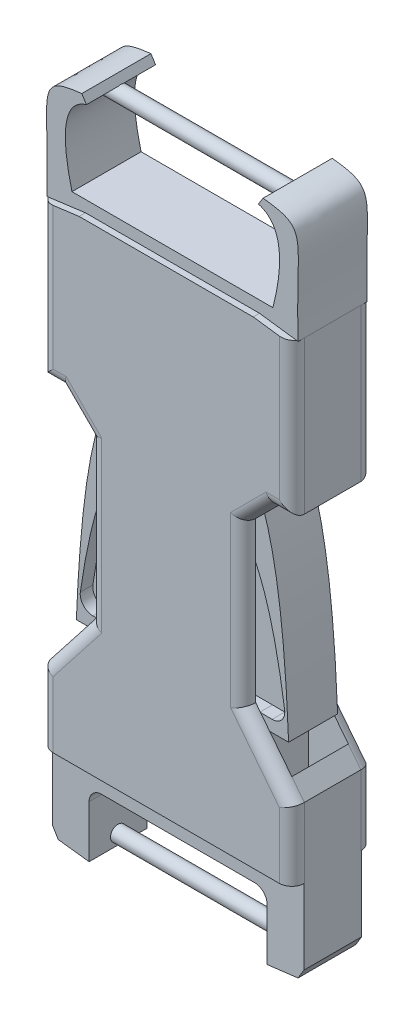
from build123d import *

# Parameters (mm, degrees)
BOSS_EXTRUDE1_DEPTH      = 3.25
FILLET1_R                = 1
SKETCH2_W                = 18
SKETCH2_H                = 4.5
CUT_EXTRUDE1_DEPTH       = 36.5
BOSS_EXTRUDE2_START      = -0.5
BOSS_EXTRUDE2_DEPTH      = 5.5
BOSS_EXTRUDE3_DEPTH      = 8
BOSS_EXTRUDE3_DEPTH_BACK = 8
SKETCH4_R                = 0.6
BOSS_EXTRUDE4_DEPTH      = 1.95
BOSS_EXTRUDE5_START      = -0.95
BOSS_EXTRUDE5_DEPTH      = 4.6
BOSS_EXTRUDE6_DEPTH      = 8
BOSS_EXTRUDE6_DEPTH_BACK = 8
SKETCH7_R                = 0.6
CUT_EXTRUDE2_DEPTH       = 1


with BuildPart() as part:
    # Sketch1 → Boss-Extrude1 (new, symmetric)
    with BuildSketch(Plane.XY):
        Polygon((-10, 0), (10, 0), (10, 5.578463525), (6.128391074, 10.519600419), (6.128391074, 23.209218293), (8.361453288, 25.442280507), (10, 25.442280507), (10, 37.592736366), (6.927346301, 38), (-6.927346301, 38), (-10, 37.592736366), (-10, 25.442280507), (-8.361453288, 25.442280507), (-6.128391074, 23.209218293), (-6.128391074, 10.519600419), (-10, 5.578463525), align=None)
    extrude(amount=BOSS_EXTRUDE1_DEPTH, both=True)

    # Fillet1
    fillet1_edges = [part.edges().sort_by_distance(p)[0] for p in [
        (6.128391074, 16.864409356, 3.25),
        (7.244922181, 24.3257494, 3.25),
        (-10, 2.789231762, -3.25),
        (-8.064195537, 8.049031972, -3.25),
        (-6.128391074, 16.864409356, -3.25),
        (-7.244922181, 24.3257494, -3.25),
        (9.180726644, 25.442280507, 3.25),
        (-9.180726644, 25.442280507, -3.25),
        (-10, 31.517508436, -3.25),
        (10, 31.517508436, -3.25),
        (9.180726644, 25.442280507, -3.25),
        (7.244922181, 24.3257494, -3.25),
        (10, 31.517508436, 3.25),
        (6.128391074, 16.864409356, -3.25),
        (8.064195537, 8.049031972, -3.25),
        (10, 2.789231762, -3.25),
        (-10, 31.517508436, 3.25),
        (-9.180726644, 25.442280507, 3.25),
        (-7.244922181, 24.3257494, 3.25),
        (10, 2.789231762, 3.25),
        (-6.128391074, 16.864409356, 3.25),
        (-8.064195537, 8.049031972, 3.25),
        (-10, 2.789231762, 3.25),
        (8.064195537, 8.049031972, 3.25),
    ]]
    fillet(fillet1_edges, radius=FILLET1_R)

    # Sketch2 → Cut-Extrude1 (cut)
    with BuildSketch(Plane.XZ):
        Rectangle(SKETCH2_W, SKETCH2_H)
    extrude(amount=-CUT_EXTRUDE1_DEPTH, mode=Mode.SUBTRACT)

    # Sketch3 → Boss-Extrude2 (add)
    with BuildSketch(Plane.XY.offset(3.25).offset(BOSS_EXTRUDE2_START)):
        with BuildLine():
            Line((9.5, 37.659008663), (10, 37.592736366))
            add(Edge.make_bspline(
                [(10, 37.592736366), (9.746832073, 44.823923253), (11.058512461, 45.65315717), (7.212461324, 46.074663285)],
                knots=[0, 0, 0, 0, 1, 1, 1, 1], degree=3))
            Line((7.212461324, 46.074663285), (6.84377569, 45.492222023))
            add(Edge.make_bspline(
                [(6.84377569, 45.492222023), (9.472980504, 44.716427528), (7.994892476, 38.921496511)],
                knots=[0, 0, 0, 1, 1, 1], degree=2))
            Line((7.994892476, 38.921496511), (-7.994892476, 38.921496511))
            add(Edge.make_bspline(
                [(-6.84377569, 45.492222023), (-9.472980504, 44.716427528), (-7.994892476, 38.921496511)],
                knots=[0, 0, 0, 1, 1, 1], degree=2))
            Line((-6.84377569, 45.492222023), (-7.212461324, 46.074663285))
            add(Edge.make_bspline(
                [(-10, 37.592736366), (-9.746832073, 44.823923253), (-11.058512461, 45.65315717), (-7.212461324, 46.074663285)],
                knots=[0, 0, 0, 0, 1, 1, 1, 1], degree=3))
            Line((-10, 37.592736366), (-9.5, 37.659008663))
            Line((-9.5, 37.659008663), (9.5, 37.659008663))
        make_face()
    extrude(amount=-BOSS_EXTRUDE2_DEPTH)

    # Sketch4 → Boss-Extrude3 (add, two sides: drawn at the far end of the back side and taken through both)
    with BuildSketch(Plane(origin=(0, 0, 0), x_dir=(0, 0, -1), z_dir=(1, 0, 0)).offset(-BOSS_EXTRUDE3_DEPTH_BACK)):
        with Locations(Location((0, 44.911343347, 0), (0, 0, 334.766689981))):
            Circle(SKETCH4_R)
    extrude(amount=BOSS_EXTRUDE3_DEPTH + BOSS_EXTRUDE3_DEPTH_BACK)



with BuildPart() as body_2:
    # Sketch5 → Boss-Extrude4 (new, symmetric)
    with BuildSketch(Plane.XY):
        with BuildLine():
            Line((-1.426787146, 29.854446621), (-1.426787146, 28.74326623))
            add(Edge.make_bspline(
                [(-1.426787146, 28.74326623), (-2.951943562, 25.947146135), (-3.114776975, 10.879706809)],
                knots=[0, 0, 0, 1, 1, 1], degree=2))
            Line((-3.114776975, 10.879706809), (-3.114776975, 3.907310731))
            Line((-3.114776975, 3.907310731), (3.114776975, 3.907310731))
            Line((3.114776975, 3.907310731), (3.114776975, 10.879706809))
            add(Edge.make_bspline(
                [(1.426787146, 28.74326623), (2.951943562, 25.947146135), (3.114776975, 10.879706809)],
                knots=[0, 0, 0, 1, 1, 1], degree=2))
            Line((1.426787146, 28.74326623), (1.426787146, 29.854446621))
            add(Edge.make_bspline(
                [(1.426787146, 29.854446621), (6.17183144, 27.990322077), (7.865377084, 22.449752115), (8.44598472, 8.799281422)],
                knots=[0, 0, 0, 0, 1, 1, 1, 1], degree=3))
            Line((8.44598472, 8.799281422), (6.14508588, 8.799281422))
            Line((6.14508588, 8.799281422), (6.14508588, 0))
            Line((6.14508588, 0), (-6.14508588, 0))
            Line((-6.14508588, 0), (-6.14508588, 8.799281422))
            Line((-6.14508588, 8.799281422), (-8.44598472, 8.799281422))
            add(Edge.make_bspline(
                [(-1.426787146, 29.854446621), (-6.17183144, 27.990322077), (-7.865377084, 22.449752115), (-8.44598472, 8.799281422)],
                knots=[0, 0, 0, 0, 1, 1, 1, 1], degree=3))
        make_face()
    extrude(amount=BOSS_EXTRUDE4_DEPTH, both=True)


with BuildPart() as part_1:
    add(part.part)

    add(body_2.part)  # Boss-Extrude5 merges body 2
    # Sketch6 → Boss-Extrude5 (add)
    with BuildSketch(Plane.XY.offset(3.25).offset(BOSS_EXTRUDE5_START)):
        with BuildLine():
            Line((10, 0), (-10, 0))
            Line((-10, 0), (-10, -5.963492263))
            Line((-10, -5.963492263), (-9.542070031, -6.72669282))
            Line((-9.542070031, -6.72669282), (-7.081807095, -7.026940283))
            Line((-7.081807095, -7.026940283), (-7.081807095, -2.881433173))
            ThreePointArc((-7.081807095, -2.881433173), (-6.788913876, -2.174326392), (-6.081807095, -1.881433173))
            Line((-6.081807095, -1.881433173), (6.081807095, -1.881433173))
            ThreePointArc((6.081807095, -1.881433173), (6.788913876, -2.174326392), (7.081807095, -2.881433173))
            Line((7.081807095, -2.881433173), (7.081807095, -7.026940283))
            Line((7.081807095, -7.026940283), (9.542070031, -6.72669282))
            Line((9.542070031, -6.72669282), (10, -5.963492263))
            Line((10, -5.963492263), (10, 0))
        make_face()
    extrude(amount=-BOSS_EXTRUDE5_DEPTH)

    # Sketch7 → Boss-Extrude6 (add, two sides: drawn at the far end of the back side and taken through both)
    with BuildSketch(Plane(origin=(0, 0, 0), x_dir=(0, 0, -1), z_dir=(1, 0, 0)).offset(-BOSS_EXTRUDE6_DEPTH_BACK)):
        with Locations((0, -6.19159642)):
            Circle(SKETCH7_R)
    extrude(amount=BOSS_EXTRUDE6_DEPTH + BOSS_EXTRUDE6_DEPTH_BACK)

    # Sketch8 → Cut-Extrude2 (cut)
    with BuildSketch(Plane(origin=(0, 0, -1.95), x_dir=(-1, 0, 0), z_dir=(0, 0, -1))):
        with BuildLine():
            Line((4.573681796, 20.309531494), (4.573681796, 9.728922587))
            Line((4.573681796, 9.728922587), (6.160778736, 9.728922587))
            Line((6.160778736, 9.728922587), (7.13018798, 9.719708419))
            ThreePointArc((7.13018798, 9.719708419), (7.892824614, 10.061793969), (8.129295154, 10.863491445))
            add(Edge.make_bspline(
                [(8.129295154, 10.863491445), (8.09817469, 11.077614237), (8.001251794, 11.7258942), (7.766888807, 13.157429508), (7.396665666, 15.04731467), (6.898480524, 17.029627485), (6.343546796, 18.734618508), (5.751398713, 20.115997517), (5.330262425, 20.854004041), (5.123739938, 21.167247176)],
                knots=[0.053188195, 0.053188195, 0.053188195, 0.053188195, 0.079276794, 0.132604524, 0.239259984, 0.345915445, 0.452570905, 0.559226366, 0.655924956, 0.655924956, 0.655924956, 0.655924956], degree=3))
            Line((5.123739938, 21.167247176), (4.573681796, 20.309531494))
        make_face()
        with BuildLine():
            Line((-5.123739938, 21.167247176), (-4.573681796, 20.309531494))
            Line((-4.573681796, 20.309531494), (-4.573681796, 9.728922587))
            Line((-4.573681796, 9.728922587), (-6.160778736, 9.728922587))
            Line((-6.160778736, 9.728922587), (-7.13018798, 9.719708419))
            ThreePointArc((-7.13018798, 9.719708419), (-7.892824614, 10.061793969), (-8.129295154, 10.863491445))
            add(Edge.make_bspline(
                [(-8.129295154, 10.863491445), (-8.09817469, 11.077614237), (-8.001251794, 11.7258942), (-7.766888807, 13.157429508), (-7.396665666, 15.04731467), (-6.898480524, 17.029627485), (-6.343546796, 18.734618508), (-5.751398713, 20.115997517), (-5.330262425, 20.854004041), (-5.123739938, 21.167247176)],
                knots=[0.053188195, 0.053188195, 0.053188195, 0.053188195, 0.079276794, 0.132604524, 0.239259984, 0.345915445, 0.452570905, 0.559226366, 0.655924956, 0.655924956, 0.655924956, 0.655924956], degree=3))
        make_face()
    cut_extrude2 = extrude(amount=-CUT_EXTRUDE2_DEPTH, mode=Mode.SUBTRACT)

    # Mirror2: Cut-Extrude2 across plane
    add(cut_extrude2.mirror(Plane.XY), mode=Mode.SUBTRACT)


solid = part_1.part
